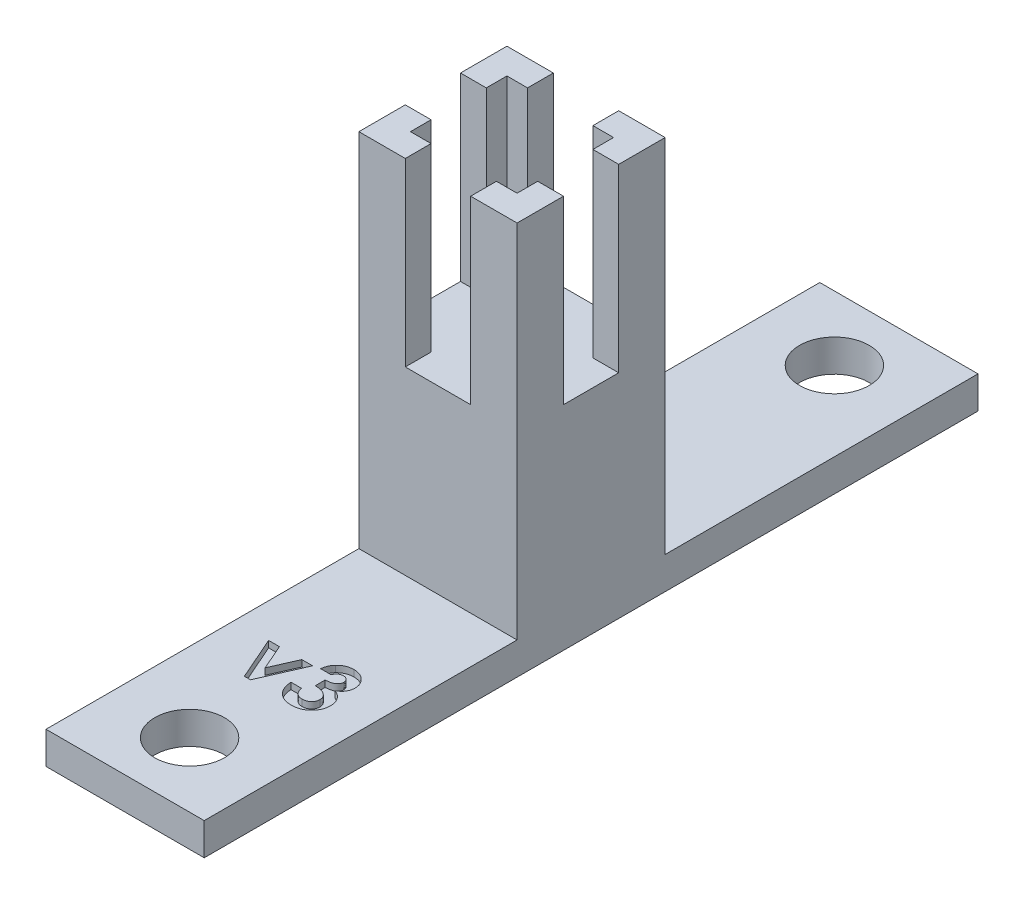
from build123d import *

# Parameters (mm, degrees)
BOSS_EXTRUDE1_DEPTH   = 17.78
BOSS_EXTRUDE1_2_DEPTH = 17.78
BOSS_EXTRUDE1_3_DEPTH = 17.78
BOSS_EXTRUDE1_4_DEPTH = 17.78
SKETCH2_W             = 15.58
SKETCH2_H             = 14.58
BOSS_EXTRUDE2_DEPTH   = 17.78
SKETCH3_W             = 15.58
SKETCH3_H             = 76.2
SKETCH3_R             = 3.429
BOSS_EXTRUDE3_DEPTH   = 3.175
CUT_EXTRUDE3_DEPTH    = 0.635


with BuildPart() as part:
    # Sketch1 → Boss-Extrude1 (new body)
    with BuildSketch(Plane(origin=(0, 0, 0), x_dir=(1, 0, 0), z_dir=(0, 1, 0))):
        Polygon((-5.25, 4.75), (-5.25, 2.718), (-7.79, 2.718), (-7.79, 7.29), (-3.218, 7.29), (-3.218, 4.75), align=None)
    extrude(amount=BOSS_EXTRUDE1_DEPTH)



with BuildPart() as body_2:
    # Sketch1 → Boss-Extrude1 2 (new body)
    with BuildSketch(Plane(origin=(0, 0, 0), x_dir=(1, 0, 0), z_dir=(0, 1, 0))):
        Polygon((7.79, 2.718), (7.79, 7.29), (3.218, 7.29), (3.218, 4.75), (5.25, 4.75), (5.25, 2.718), align=None)
    extrude(amount=BOSS_EXTRUDE1_2_DEPTH)


with BuildPart() as body_3:
    # Sketch1 → Boss-Extrude1 3 (new body)
    with BuildSketch(Plane(origin=(0, 0, 0), x_dir=(1, 0, 0), z_dir=(0, 1, 0))):
        Polygon((5.25, -2.718), (7.79, -2.718), (7.79, -7.29), (3.218, -7.29), (3.218, -4.75), (5.25, -4.75), align=None)
    extrude(amount=BOSS_EXTRUDE1_3_DEPTH)


with BuildPart() as body_4:
    # Sketch1 → Boss-Extrude1 4 (new body)
    with BuildSketch(Plane(origin=(0, 0, 0), x_dir=(1, 0, 0), z_dir=(0, 1, 0))):
        Polygon((-5.25, -2.718), (-7.79, -2.718), (-7.79, -7.29), (-3.218, -7.29), (-3.218, -4.75), (-5.25, -4.75), align=None)
    extrude(amount=BOSS_EXTRUDE1_4_DEPTH)


with BuildPart() as part_1:
    add(part.part)

    add(body_2.part)  # Boss-Extrude2 merges body 2

    add(body_3.part)  # Boss-Extrude2 merges body 3

    add(body_4.part)  # Boss-Extrude2 merges body 4
    # Sketch2 → Boss-Extrude2 (add)
    with BuildSketch(Plane(origin=(0, 0, 0), x_dir=(-1, 0, 0), z_dir=(0, -1, 0))):
        Rectangle(SKETCH2_W, SKETCH2_H)
    extrude(amount=BOSS_EXTRUDE2_DEPTH)

    # Sketch3 → Boss-Extrude3 (add)
    with BuildSketch(Plane(origin=(0, -17.78, 0), x_dir=(-1, 0, 0), z_dir=(0, -1, 0))):
        Rectangle(SKETCH3_W, SKETCH3_H)
        with Locations(Location((0, 31.75, 0), (0, 0, 90))):
            Circle(SKETCH3_R, mode=Mode.SUBTRACT)
        with Locations(Location((0, -31.75, 0), (0, 0, 270))):
            Circle(SKETCH3_R, mode=Mode.SUBTRACT)
    extrude(amount=BOSS_EXTRUDE3_DEPTH)

    # Sketch5 → Cut-Extrude3 (cut)
    with BuildSketch(Plane(origin=(0, -17.78, 0), x_dir=(1, 0, 0), z_dir=(0, 1, 0))):
        Polygon((-4.402938034, -19.56265828), (-3.33951656, -19.56265828), (-2.238782051, -22.073125862), (-1.138047543, -19.56265828), (-0.074626068, -19.56265828), (-1.937945713, -23.816344178), (-2.539618389, -23.816344178), align=None)
        with BuildLine():
            Line((1.60446047, -19.413406143), (0.559695513, -19.413406143))
            add(Edge.make_bspline(
                [(0.559695513, -19.413406143), (0.567071951, -19.36118207), (0.581532969, -19.258800234), (0.616136251, -19.110576841), (0.65752551, -18.969976808), (0.709197886, -18.837445387), (0.769801176, -18.712746497), (0.838719113, -18.59545223), (0.916696725, -18.486066037), (0.976467391, -18.42017136), (1.006285891, -18.387297703)],
                knots=[0, 0, 0, 0, 1.111473889, 2.178970933, 3.205615836, 4.199322666, 5.174200091, 6.12565194, 7.064921805, 8, 8, 8, 8], degree=3))
            add(Edge.make_bspline(
                [(1.006285891, -18.387297703), (1.049295125, -18.343923295), (1.134061806, -18.258436894), (1.275716871, -18.148938257), (1.424197539, -18.054174633), (1.582481657, -17.979045347), (1.748106202, -17.918236894), (1.922388279, -17.877391718), (2.104615709, -17.850290583), (2.228963005, -17.847621027), (2.292419538, -17.846258707)],
                knots=[0, 0, 0, 0, 1.01925491, 2.00884431, 2.983262333, 3.955970413, 4.92937149, 5.924503185, 6.940838805, 8, 8, 8, 8], degree=3))
            add(Edge.make_bspline(
                [(2.292419538, -17.846258707), (2.34883566, -17.847590582), (2.459738389, -17.850208778), (2.622737494, -17.871226235), (2.778143501, -17.908088515), (2.927599095, -17.956285119), (3.068906271, -18.021864654), (3.205183817, -18.097988535), (3.332624133, -18.19135764), (3.451525404, -18.296855331), (3.5607589, -18.410961412), (3.655355585, -18.532931428), (3.736682053, -18.65950728), (3.803684306, -18.791740573), (3.855199933, -18.929855061), (3.890953306, -19.073052878), (3.914354757, -19.221018044), (3.916686153, -19.321587975), (3.91786859, -19.372595012)],
                knots=[0, 0, 0, 0, 1.091422571, 2.145516843, 3.172569842, 4.178562979, 5.178154469, 6.181868002, 7.194278174, 8.227918432, 9.254613415, 10.245994977, 11.209837596, 12.161663635, 13.10878368, 14.055455738, 15.013766427, 16, 16, 16, 16], degree=3))
            add(Edge.make_bspline(
                [(3.91786859, -19.372595012), (3.915442158, -19.435762981), (3.910665261, -19.56012129), (3.871467362, -19.742128915), (3.810111989, -19.916160685), (3.721478187, -20.079781634), (3.610663359, -20.232546477), (3.474697276, -20.369347828), (3.317452606, -20.492330546), (3.199406937, -20.558421473), (3.138959001, -20.592264817)],
                knots=[0, 0, 0, 0, 0.992805628, 1.954529043, 2.915727527, 3.886831945, 4.871318353, 5.87440735, 6.911542536, 8, 8, 8, 8], degree=3))
            add(Edge.make_bspline(
                [(3.138959001, -20.592264817), (3.180449537, -20.605887034), (3.26197658, -20.632654079), (3.377857468, -20.68537147), (3.488046952, -20.742982841), (3.590647607, -20.809912067), (3.686679921, -20.883452827), (3.775558471, -20.964233774), (3.857814283, -21.052078768), (3.932104567, -21.147470922), (3.998040097, -21.248884626), (4.057200536, -21.353977283), (4.105892876, -21.464342641), (4.14714135, -21.578720254), (4.178545589, -21.698138088), (4.20065698, -21.822133409), (4.213437907, -21.950423374), (4.215387216, -22.037339748), (4.216372863, -22.081288088)],
                knots=[0, 0, 0, 0, 1.059543567, 2.081955587, 3.086750234, 4.076226789, 5.052108497, 6.020845489, 6.989030705, 7.970690546, 8.952259656, 9.923888338, 10.895517021, 11.877585046, 12.873342345, 13.889638361, 14.932918083, 16, 16, 16, 16], degree=3))
            add(Edge.make_bspline(
                [(4.216372863, -22.081288088), (4.214374823, -22.145874304), (4.210435096, -22.273225169), (4.18538815, -22.460799959), (4.13875525, -22.639635857), (4.077407087, -22.811790639), (3.995575297, -22.975041849), (3.899273036, -23.13313588), (3.780898209, -23.280590074), (3.649344914, -23.421302739), (3.503247311, -23.549232393), (3.344853741, -23.660141646), (3.177647143, -23.755321519), (3.00056965, -23.832591251), (2.81368278, -23.892097783), (2.61740309, -23.935111847), (2.410905865, -23.961428562), (2.269955352, -23.964187371), (2.19797092, -23.965596314)],
                knots=[0, 0, 0, 0, 1.005138573, 1.981928558, 2.936866704, 3.876260664, 4.820238198, 5.773547, 6.751179199, 7.756627054, 8.768222608, 9.766606018, 10.760583154, 11.757261445, 12.767156078, 13.807575856, 14.880313354, 16, 16, 16, 16], degree=3))
            add(Edge.make_bspline(
                [(2.19797092, -23.965596314), (2.129874809, -23.964110822), (1.996721873, -23.961206138), (1.801957838, -23.936064626), (1.616853058, -23.895509328), (1.440935143, -23.838343272), (1.274884705, -23.764208666), (1.117195935, -23.675930985), (0.971015477, -23.568418577), (0.834714593, -23.446524755), (0.711316847, -23.309766808), (0.601028322, -23.161312666), (0.506280899, -23.000597819), (0.426686017, -22.828308906), (0.362865929, -22.644143683), (0.31252483, -22.448476657), (0.277360749, -22.240925557), (0.266651455, -22.098125985), (0.261191239, -22.025318537)],
                knots=[0, 0, 0, 0, 1.066544725, 2.085487077, 3.070979577, 4.031932826, 4.977951092, 5.916076795, 6.857635327, 7.814973522, 8.776389752, 9.738577119, 10.707772778, 11.69409279, 12.707140348, 13.757286496, 14.856535458, 16, 16, 16, 16], degree=3))
            Line((0.261191239, -22.025318537), (1.305956197, -22.025318537))
            add(Edge.make_bspline(
                [(1.305956197, -22.025318537), (1.312576763, -22.061927077), (1.325472053, -22.133231811), (1.350623524, -22.236465214), (1.383399401, -22.331756021), (1.421296469, -22.419951174), (1.462231007, -22.502208645), (1.511689719, -22.575490462), (1.566048529, -22.641786528), (1.644488688, -22.72060002), (1.756624298, -22.801577594), (1.908044521, -22.871950958), (2.076485181, -22.913198395), (2.194242, -22.918230456), (2.255106504, -22.920831357)],
                knots=[0, 0, 0, 0, 0.928156231, 1.807827665, 2.648129825, 3.438902246, 4.202261636, 4.936546065, 5.639352463, 6.338805438, 7.70633318, 9.064371875, 10.482673459, 12, 12, 12, 12], degree=3))
            add(Edge.make_bspline(
                [(2.255106504, -22.920831357), (2.287403361, -22.92027752), (2.350665678, -22.919192676), (2.443588602, -22.907168637), (2.53211077, -22.887365035), (2.616397061, -22.860452674), (2.696984046, -22.826716347), (2.772332028, -22.783215372), (2.84397679, -22.732639278), (2.911139487, -22.675778323), (2.973199203, -22.613820236), (3.024836536, -22.545212181), (3.072029323, -22.475494135), (3.106933447, -22.400104897), (3.13751698, -22.323101214), (3.156235665, -22.241688093), (3.170369616, -22.157573363), (3.171191024, -22.100008934), (3.171607906, -22.070793797)],
                knots=[0, 0, 0, 0, 1.110435564, 2.175094844, 3.216326037, 4.226890168, 5.215276772, 6.21526065, 7.213097102, 8.228249917, 9.239874822, 10.221364777, 11.178138315, 12.128914389, 13.072518965, 14.022636769, 14.996447288, 16, 16, 16, 16], degree=3))
            add(Edge.make_bspline(
                [(3.171607906, -22.070793797), (3.170501163, -22.038842067), (3.168297891, -21.975233493), (3.150296928, -21.882410155), (3.121869603, -21.793121585), (3.082380576, -21.707763195), (3.029647382, -21.626649598), (2.9674228, -21.548153411), (2.890804565, -21.47636022), (2.806744099, -21.405394826), (2.709266982, -21.343534406), (2.603120486, -21.286446328), (2.485514916, -21.241021842), (2.35932113, -21.200449362), (2.222152054, -21.170815853), (2.074859456, -21.149299038), (1.917680943, -21.133283103), (1.809335751, -21.130985354), (1.753712607, -21.129805716)],
                knots=[0, 0, 0, 0, 0.809814727, 1.612155564, 2.388397, 3.182215007, 3.988903953, 4.837162975, 5.715530372, 6.646997145, 7.623086902, 8.637258368, 9.698941581, 10.815059213, 11.996518529, 13.252603015, 14.589518788, 16, 16, 16, 16], degree=3))
            Line((1.753712607, -21.129805716), (1.753712607, -20.159666827))
            add(Edge.make_bspline(
                [(1.753712607, -20.159666827), (1.822966729, -20.153768925), (1.952527477, -20.142735117), (2.132364742, -20.116932174), (2.283764537, -20.082442292), (2.410365759, -20.040832116), (2.515487302, -19.98739381), (2.607320901, -19.92840028), (2.686412341, -19.859887916), (2.753255217, -19.783899748), (2.806727438, -19.702295581), (2.844571961, -19.616343786), (2.869562507, -19.528703818), (2.871930359, -19.468760721), (2.873103632, -19.439058854)],
                knots=[0, 0, 0, 0, 1.70044513, 3.18119609, 4.440695891, 5.496282586, 6.431922213, 7.318171381, 8.16090191, 8.983045123, 9.787564368, 10.536848927, 11.275007137, 12, 12, 12, 12], degree=3))
            add(Edge.make_bspline(
                [(2.873103632, -19.439058854), (2.8710794, -19.401162498), (2.867128528, -19.327196833), (2.83644391, -19.221336386), (2.783178889, -19.126970571), (2.71175985, -19.044297961), (2.624733268, -18.975243601), (2.522722857, -18.925111313), (2.40794225, -18.895656355), (2.327187908, -18.892602868), (2.285423344, -18.891023665)],
                knots=[0, 0, 0, 0, 1.009664648, 1.970651636, 2.907870547, 3.878035693, 4.867062054, 5.849714035, 6.887914197, 8, 8, 8, 8], degree=3))
            add(Edge.make_bspline(
                [(2.285423344, -18.891023665), (2.247568462, -18.892886959), (2.172452782, -18.896584305), (2.062611175, -18.924180317), (1.958298243, -18.970634769), (1.861674014, -19.03469272), (1.774133277, -19.111623605), (1.702287588, -19.202732269), (1.642529751, -19.302560235), (1.617199978, -19.376312658), (1.60446047, -19.413406143)],
                knots=[0, 0, 0, 0, 0.98818071, 1.960853194, 2.938124878, 3.957524365, 4.978590984, 5.968022688, 6.978025184, 8, 8, 8, 8], degree=3))
        make_face()
    extrude(amount=-CUT_EXTRUDE3_DEPTH, mode=Mode.SUBTRACT)


solid = part_1.part
